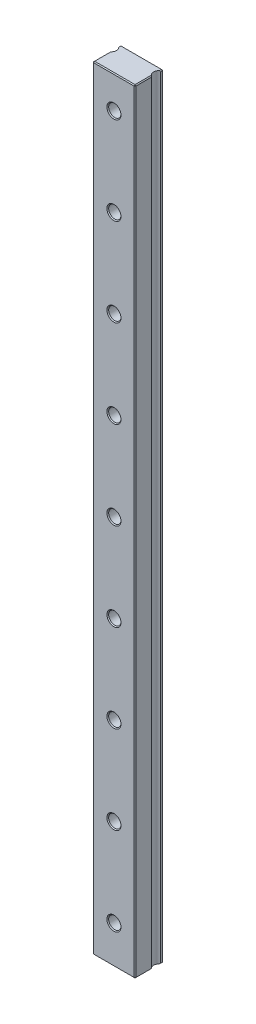
from build123d import *

# Parameters (mm, degrees)
BOSS_EXTRUDE1_DEPTH = 220
SKETCH3_R           = 1.75
CUT_EXTRUDE3_DEPTH  = 8.5
SKETCH3_6_R         = 3.25
SKETCH3_6_R_2       = 1.75
CUT_EXTRUDE4_DEPTH  = 4.5
CHAMFER3_SIZE       = 0.25


with BuildPart() as part:
    # Sketch1 → Boss-Extrude1 (new body)
    with BuildSketch(Plane(origin=(0, 0, 0), x_dir=(1, 0, 0), z_dir=(0, 1, 0))):
        with BuildLine():
            Line((6, 4), (-6, 4))
            Line((-6, 4), (-6, 3.299038106))
            ThreePointArc((-6, 3.299038106), (-5.25, 2), (-6, 0.700961894))
            Line((-6, 0.700961894), (-6, -4))
            Line((-6, -4), (6, -4))
            Line((6, -4), (6, 0.700961894))
            ThreePointArc((6, 0.700961894), (5.25, 2), (6, 3.299038106))
            Line((6, 3.299038106), (6, 4))
        make_face()
    extrude(amount=BOSS_EXTRUDE1_DEPTH)

    # Sketch3 → Cut-Extrude3 (cut)
    with BuildSketch(Plane(origin=(0, 0, -4), x_dir=(-1, 0, 0), z_dir=(0, 0, -1))):
        with Locations((0, 10.75)):
            Circle(SKETCH3_R)
        with Locations((0, 35.75)):
            Circle(SKETCH3_R)
        with Locations((0, 60.75)):
            Circle(SKETCH3_R)
        with Locations((0, 85.75)):
            Circle(SKETCH3_R)
        with Locations((0, 110.75)):
            Circle(SKETCH3_R)
        with Locations((0, 135.75)):
            Circle(SKETCH3_R)
        with Locations((0, 160.75)):
            Circle(SKETCH3_R)
        with Locations((0, 185.75)):
            Circle(SKETCH3_R)
        with Locations((0, 210.75)):
            Circle(SKETCH3_R)
        with Locations((0, 235.75)):
            Circle(SKETCH3_R)
        with Locations((0, 260.75)):
            Circle(SKETCH3_R)
        with Locations((0, 285.75)):
            Circle(SKETCH3_R)
        with Locations((0, 310.75)):
            Circle(SKETCH3_R)
        with Locations((0, 335.75)):
            Circle(SKETCH3_R)
    extrude(amount=-CUT_EXTRUDE3_DEPTH, mode=Mode.SUBTRACT)

    # Sketch3<6> → Cut-Extrude4 (cut)
    # profile 1 of 14: a face of its own
    with BuildSketch(Plane(origin=(0, 0, -4), x_dir=(-1, 0, 0), z_dir=(0, 0, -1))):
        with Locations((0, 10.75)):
            Circle(SKETCH3_6_R)
        with Locations((0, 10.75)):
            Circle(SKETCH3_6_R_2, mode=Mode.SUBTRACT)
    # profile 2 of 14: a face of its own
    with BuildSketch(Plane(origin=(0, 0, -4), x_dir=(-1, 0, 0), z_dir=(0, 0, -1))):
        with Locations((0, 35.75)):
            Circle(SKETCH3_6_R)
        with Locations((0, 35.75)):
            Circle(SKETCH3_6_R_2, mode=Mode.SUBTRACT)
    # profile 3 of 14: a face of its own
    with BuildSketch(Plane(origin=(0, 0, -4), x_dir=(-1, 0, 0), z_dir=(0, 0, -1))):
        with Locations((0, 60.75)):
            Circle(SKETCH3_6_R)
        with Locations((0, 60.75)):
            Circle(SKETCH3_6_R_2, mode=Mode.SUBTRACT)
    # profile 4 of 14: a face of its own
    with BuildSketch(Plane(origin=(0, 0, -4), x_dir=(-1, 0, 0), z_dir=(0, 0, -1))):
        with Locations((0, 85.75)):
            Circle(SKETCH3_6_R)
        with Locations((0, 85.75)):
            Circle(SKETCH3_6_R_2, mode=Mode.SUBTRACT)
    # profile 5 of 14: a face of its own
    with BuildSketch(Plane(origin=(0, 0, -4), x_dir=(-1, 0, 0), z_dir=(0, 0, -1))):
        with Locations((0, 110.75)):
            Circle(SKETCH3_6_R)
        with Locations((0, 110.75)):
            Circle(SKETCH3_6_R_2, mode=Mode.SUBTRACT)
    # profile 6 of 14: a face of its own
    with BuildSketch(Plane(origin=(0, 0, -4), x_dir=(-1, 0, 0), z_dir=(0, 0, -1))):
        with Locations((0, 135.75)):
            Circle(SKETCH3_6_R)
        with Locations((0, 135.75)):
            Circle(SKETCH3_6_R_2, mode=Mode.SUBTRACT)
    # profile 7 of 14: a face of its own
    with BuildSketch(Plane(origin=(0, 0, -4), x_dir=(-1, 0, 0), z_dir=(0, 0, -1))):
        with Locations((0, 160.75)):
            Circle(SKETCH3_6_R)
        with Locations((0, 160.75)):
            Circle(SKETCH3_6_R_2, mode=Mode.SUBTRACT)
    # profile 8 of 14: a face of its own
    with BuildSketch(Plane(origin=(0, 0, -4), x_dir=(-1, 0, 0), z_dir=(0, 0, -1))):
        with Locations((0, 185.75)):
            Circle(SKETCH3_6_R)
        with Locations((0, 185.75)):
            Circle(SKETCH3_6_R_2, mode=Mode.SUBTRACT)
    # profile 9 of 14: a face of its own
    with BuildSketch(Plane(origin=(0, 0, -4), x_dir=(-1, 0, 0), z_dir=(0, 0, -1))):
        with Locations((0, 210.75)):
            Circle(SKETCH3_6_R)
        with Locations((0, 210.75)):
            Circle(SKETCH3_6_R_2, mode=Mode.SUBTRACT)
    # profile 10 of 14: a face of its own
    with BuildSketch(Plane(origin=(0, 0, -4), x_dir=(-1, 0, 0), z_dir=(0, 0, -1))):
        with Locations((0, 235.75)):
            Circle(SKETCH3_6_R)
        with Locations((0, 235.75)):
            Circle(SKETCH3_6_R_2, mode=Mode.SUBTRACT)
    # profile 11 of 14: a face of its own
    with BuildSketch(Plane(origin=(0, 0, -4), x_dir=(-1, 0, 0), z_dir=(0, 0, -1))):
        with Locations((0, 260.75)):
            Circle(SKETCH3_6_R)
        with Locations((0, 260.75)):
            Circle(SKETCH3_6_R_2, mode=Mode.SUBTRACT)
    # profile 12 of 14: a face of its own
    with BuildSketch(Plane(origin=(0, 0, -4), x_dir=(-1, 0, 0), z_dir=(0, 0, -1))):
        with Locations((0, 285.75)):
            Circle(SKETCH3_6_R)
        with Locations((0, 285.75)):
            Circle(SKETCH3_6_R_2, mode=Mode.SUBTRACT)
    # profile 13 of 14: a face of its own
    with BuildSketch(Plane(origin=(0, 0, -4), x_dir=(-1, 0, 0), z_dir=(0, 0, -1))):
        with Locations((0, 310.75)):
            Circle(SKETCH3_6_R)
        with Locations((0, 310.75)):
            Circle(SKETCH3_6_R_2, mode=Mode.SUBTRACT)
    # profile 14 of 14: a face of its own
    with BuildSketch(Plane(origin=(0, 0, -4), x_dir=(-1, 0, 0), z_dir=(0, 0, -1))):
        with Locations((0, 335.75)):
            Circle(SKETCH3_6_R)
        with Locations((0, 335.75)):
            Circle(SKETCH3_6_R_2, mode=Mode.SUBTRACT)
    extrude(amount=-CUT_EXTRUDE4_DEPTH, mode=Mode.SUBTRACT)

    # Chamfer3
    chamfer3_edges = [part.edges().sort_by_distance(p)[0] for p in [
        (1.75, 210.75, 4),
        (1.75, 185.75, 4),
        (1.75, 160.75, 4),
        (1.75, 135.75, 4),
        (1.75, 110.75, 4),
        (1.75, 85.75, 4),
        (1.75, 60.75, 4),
        (1.75, 35.75, 4),
        (1.75, 10.75, 4),
        (0, 0, 4),
        (6, 0, 1.649519053),
        (-6, 0, 1.649519053),
        (6, 220, 1.649519053),
        (-6, 220, 1.649519053),
        (6, 110, 4),
        (0, 220, 4),
        (-6, 110, 4),
        (6, 0, -3.649519053),
        (-6, 0, -3.649519053),
        (0, 0, -4),
        (6, 220, -3.649519053),
        (-6, 220, -3.649519053),
        (-6, 110, -4),
        (0, 220, -4),
        (6, 110, -4),
        (3.25, 210.75, -4),
        (1.75, 210.75, 0.5),
        (3.25, 185.75, -4),
        (1.75, 185.75, 0.5),
        (3.25, 160.75, -4),
        (1.75, 160.75, 0.5),
        (3.25, 135.75, -4),
        (1.75, 135.75, 0.5),
        (3.25, 110.75, -4),
        (1.75, 110.75, 0.5),
        (3.25, 85.75, -4),
        (1.75, 85.75, 0.5),
        (3.25, 60.75, -4),
        (1.75, 60.75, 0.5),
        (3.25, 35.75, -4),
        (1.75, 35.75, 0.5),
        (3.25, 10.75, -4),
        (1.75, 10.75, 0.5),
    ]]
    chamfer(chamfer3_edges, length=CHAMFER3_SIZE)


solid = part.part
